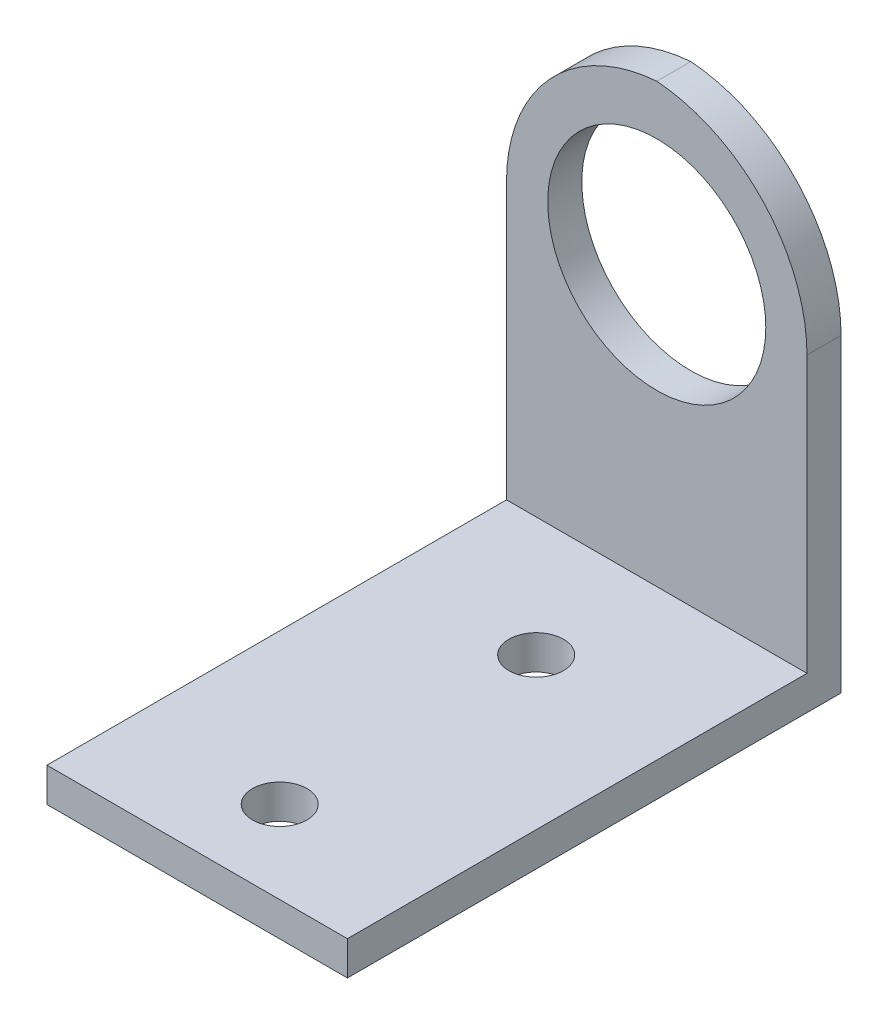
from build123d import *

# Parameters (mm, degrees)
CROQUIS1_R              = 25.4
SALIENTE_EXTRUIR1_DEPTH = 7.9375
CROQUIS2_W              = 70
CROQUIS2_H              = 115
CROQUIS2_R              = 6.35
SALIENTE_EXTRUIR2_DEPTH = 7.9375


with BuildPart() as part:
    # Croquis1 → Saliente-Extruir1 (new body)
    with BuildSketch(Plane.XY):
        with BuildLine():
            Line((-35, 72.154), (-35, 0))
            Line((-35, 0), (35, 0))
            Line((35, 0), (35, 72.154))
            ThreePointArc((35, 72.154), (24.903139014, 97.889287059), (0, 109.89283941))
            ThreePointArc((0, 109.89283941), (-24.903139014, 97.889287059), (-35, 72.154))
        make_face()
        with Locations((0, 72.9)):
            Circle(CROQUIS1_R, mode=Mode.SUBTRACT)
    extrude(amount=SALIENTE_EXTRUIR1_DEPTH)

    # Croquis2 → Saliente-Extruir2 (add)
    with BuildSketch(Plane.XZ):
        with Locations((0, 57.5)):
            Rectangle(CROQUIS2_W, CROQUIS2_H)
        with Locations(Location((-0.254, 35.772581169, 0), (0, 0, 270))):
            Circle(CROQUIS2_R, mode=Mode.SUBTRACT)
        with Locations(Location((0, 95.772581169, 0), (0, 0, 270))):
            Circle(CROQUIS2_R, mode=Mode.SUBTRACT)
    extrude(amount=-SALIENTE_EXTRUIR2_DEPTH)


solid = part.part
